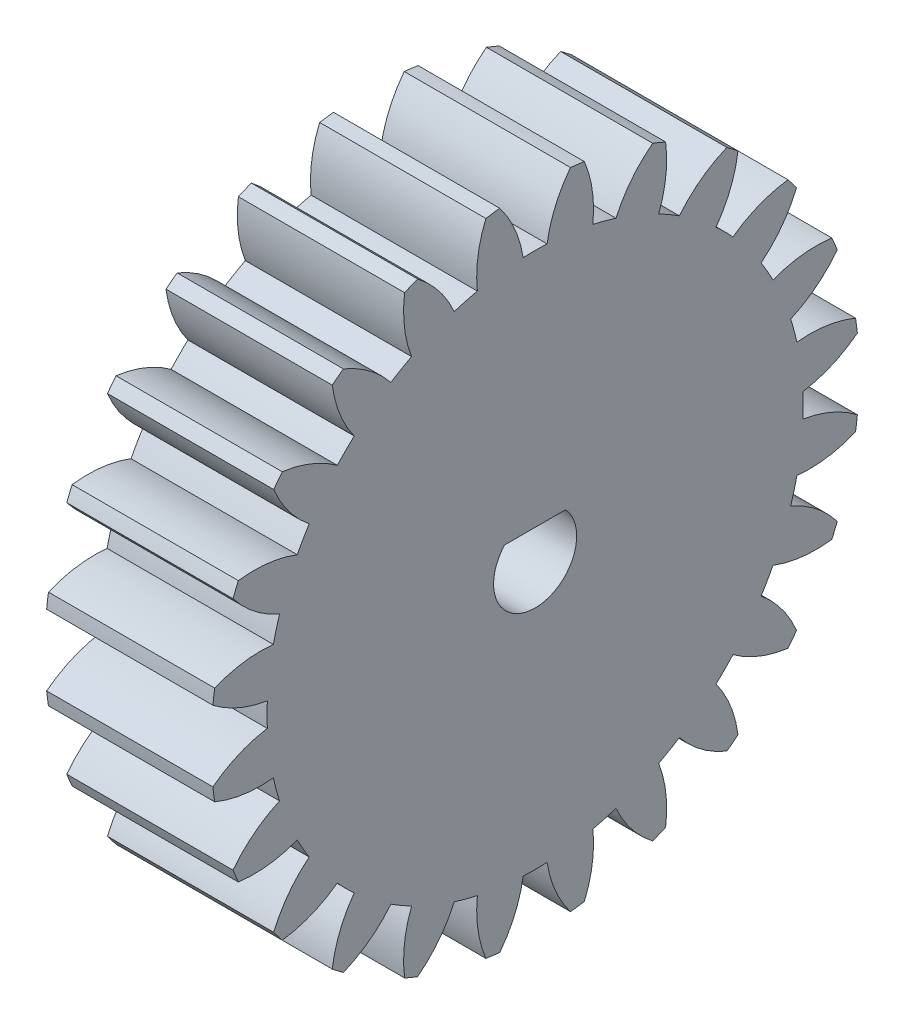
from build123d import *

# Parameters (mm, degrees)
BASPROSKE_W         = 10
BASPROSKE_H         = 19.5
TOOTHCUT_DEPTH      = 30.334280288
TEETHCUTS_COUNT     = 24
TEETHCUTS_ANGLE     = 345
BORSKE_R            = 2.5
BORE_DEPTH          = 50.0000508
BOSS_EXTRUDE1_DEPTH = 10


with BuildPart() as part:
    # BasProSke → Base-Revolve (revolve)
    with BuildSketch(Plane(origin=(0, 0, 0), x_dir=(1, 0, 0), z_dir=(0, 1, 0)), mode=Mode.PRIVATE) as base_revolve_sk:
        with Locations((5, 9.75)):
            Rectangle(BASPROSKE_W, BASPROSKE_H)
    revolve(base_revolve_sk.sketch.rotate(Axis((-10, 0, 0), (1, 0, 0)), 180), axis=Axis((-10, 0, 0), (1, 0, 0)))

    # TooCutSke → ToothCut (cut, through all)
    with BuildSketch(Plane(origin=(0, 0, 0), x_dir=(0, 0, -1), z_dir=(1, 0, 0))):
        with BuildLine():
            ThreePointArc((0.718975251, 16.107962335), (0, 16.124), (-0.718975251, 16.107962335))
            ThreePointArc((-0.718975251, 16.107962335), (-1.222639001, 17.848001425), (-2.144665446, 19.407257799))
            ThreePointArc((-2.144665446, 19.407257799), (0, 19.5254), (2.144665446, 19.407257799))
            ThreePointArc((2.144665446, 19.407257799), (1.222639001, 17.848001425), (0.718975251, 16.107962335))
        make_face()
    toothcut = extrude(amount=TOOTHCUT_DEPTH, mode=Mode.SUBTRACT)

    # TeethCuts: ToothCut ×24 about axis
    teethcuts_axis = Axis((-10, 0, 0), (1, 0, 0))
    for i in range(1, TEETHCUTS_COUNT):
        add(toothcut.rotate(teethcuts_axis, i * TEETHCUTS_ANGLE / (TEETHCUTS_COUNT - 1)), mode=Mode.SUBTRACT)

    # BorSke → Bore (cut, symmetric)
    with BuildSketch(Plane(origin=(0, 0, 0), x_dir=(0, 0, -1), z_dir=(1, 0, 0))):
        with Locations(Location((0, 0, 0), (0, 0, 180))):
            Circle(BORSKE_R)
    extrude(amount=BORE_DEPTH, both=True, mode=Mode.SUBTRACT)

    # Sketch1 → Boss-Extrude1 (add)
    with BuildSketch(Plane(origin=(10, 0, 0), x_dir=(0, 0, -1), z_dir=(1, 0, 0))):
        with BuildLine():
            Line((-1.833030278, 1.7), (1.833030278, 1.7))
            ThreePointArc((1.833030278, 1.7), (0, 2.5), (-1.833030278, 1.7))
        make_face()
    extrude(amount=-BOSS_EXTRUDE1_DEPTH)


solid = part.part
